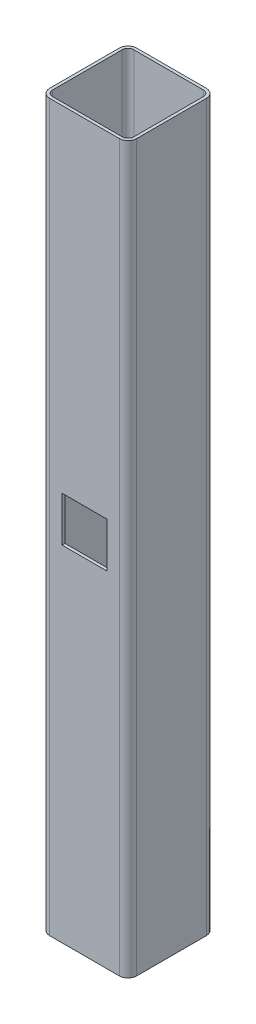
from build123d import *

# Parameters (mm, degrees)
BOSS_EXTRUDE1_DEPTH = 250
SHELL1_T            = -2
SKETCH2_W           = 31
SKETCH2_H           = 31
CUT_EXTRUDE1_DEPTH  = 259.843582111


with BuildPart() as part:
    # Sketch1 → Boss-Extrude1 (new, symmetric)
    with BuildSketch(Plane(origin=(0, 0, 0), x_dir=(1, 0, 0), z_dir=(0, 1, 0))):
        with BuildLine():
            Line((-24, -30), (24, -30))
            ThreePointArc((24, -30), (28.242640687, -28.242640687), (30, -24))
            Line((30, -24), (30, 24))
            ThreePointArc((30, 24), (28.242640687, 28.242640687), (24, 30))
            Line((24, 30), (-24, 30))
            ThreePointArc((-24, 30), (-28.242640687, 28.242640687), (-30, 24))
            Line((-30, 24), (-30, -24))
            ThreePointArc((-30, -24), (-28.242640687, -28.242640687), (-24, -30))
        make_face()
    extrude(amount=BOSS_EXTRUDE1_DEPTH, both=True)

    # Shell1
    shell1_openings = [part.faces().sort_by_distance(p)[0] for p in [
        (0, 250, 0),
        (0, -250, 0),
    ]]
    offset(amount=SHELL1_T, openings=shell1_openings, kind=Kind.INTERSECTION)

    # Sketch2 → Cut-Extrude1 (cut, through all)
    with BuildSketch(Plane(origin=(0, 0, -30), x_dir=(-1, 0, 0), z_dir=(0, 0, -1))):
        with Locations((0, 3.002147222)):
            Rectangle(SKETCH2_W, SKETCH2_H)
    extrude(amount=-CUT_EXTRUDE1_DEPTH, mode=Mode.SUBTRACT)


solid = part.part
